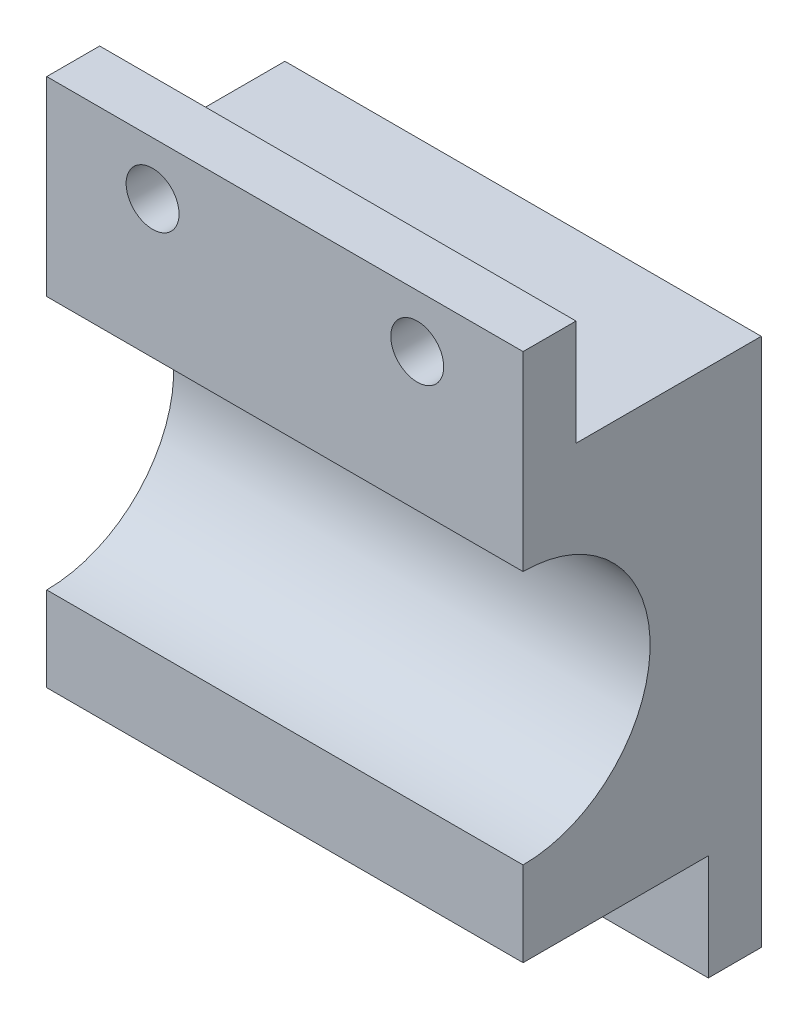
from build123d import *

# Parameters (mm, degrees)
EXTRUDE_1_DEPTH     = 45
SKETCH_2_R          = 2.5
CUT_EXTRUDE_1_DEPTH = 79.302298817


with BuildPart() as part:
    # 草图1 → 凸台-拉伸1 (new body)
    with BuildSketch(Plane(origin=(0, 0, 0), x_dir=(0, 0, -1), z_dir=(1, 0, 0))):
        with BuildLine():
            Line((0, 0), (5, 0))
            Line((5, 0), (5, -10))
            Line((5, -10), (22.5, -10))
            Line((22.5, -10), (22.5, -60))
            Line((22.5, -60), (17.5, -60))
            Line((17.5, -60), (17.5, -50))
            Line((17.5, -50), (0, -50))
            Line((0, -50), (0, -42))
            ThreePointArc((0, -42), (12, -30), (0, -18))
            Line((0, -18), (0, 0))
        make_face()
    extrude(amount=EXTRUDE_1_DEPTH)

    # 草图2 → 切除-拉伸1 (cut, through all)
    with BuildSketch(Plane(origin=(0, 0, -22.5), x_dir=(-1, 0, 0), z_dir=(0, 0, -1))):
        with Locations(Location((-35, -55, 0), (0, 0, 90))):
            Circle(SKETCH_2_R)
        with Locations(Location((-10, -5, 0), (0, 0, 90))):
            Circle(SKETCH_2_R)
        with Locations(Location((-10, -55, 0), (0, 0, 90))):
            Circle(SKETCH_2_R)
        with Locations(Location((-35, -5, 0), (0, 0, 90))):
            Circle(SKETCH_2_R)
    extrude(amount=-CUT_EXTRUDE_1_DEPTH, mode=Mode.SUBTRACT)


solid = part.part
